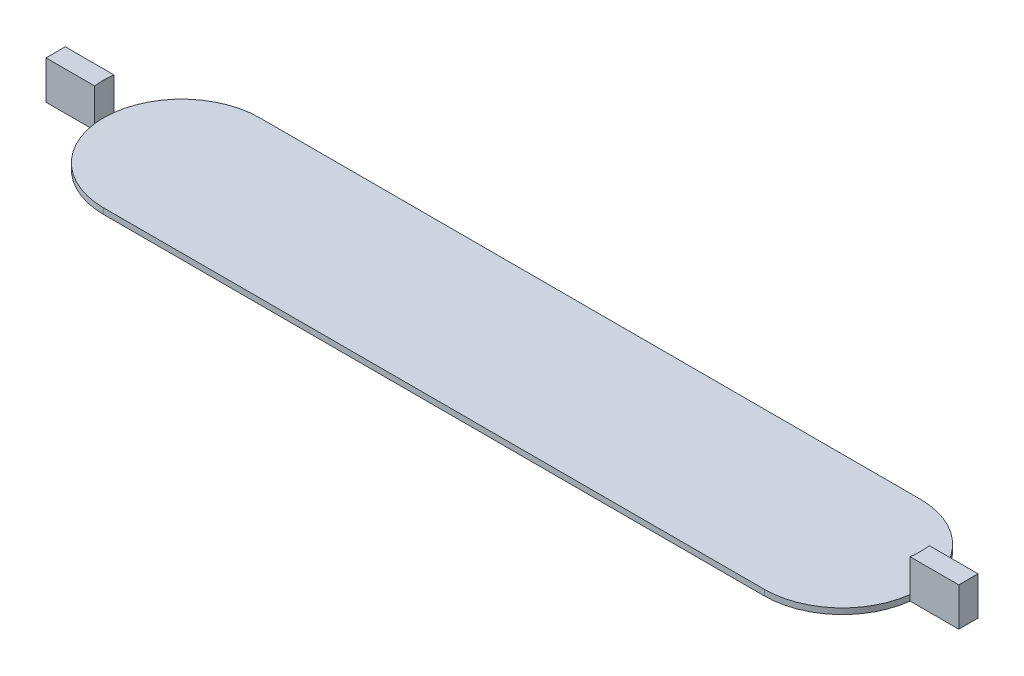
from build123d import *

# Parameters (mm, degrees)
BOSS_EXTRUDE1_DEPTH = 6
BOSS_EXTRUDE2_DEPTH = 40


with BuildPart() as part:
    # Sketch2 → Boss-Extrude1 (new body)
    with BuildSketch(Plane(origin=(0, 0, 0), x_dir=(1, 0, 0), z_dir=(0, 1, 0))):
        with BuildLine():
            Line((397.464433619, 39.544660738), (-290.127976468, 39.544660738))
            ThreePointArc((-290.127976468, 39.544660738), (-343.896082096, 19.193533205), (-370.713684353, -31.659134218))
            ThreePointArc((-370.713684353, -31.659134218), (-371.331771424, -41.659134218), (-370.713684353, -51.659134218))
            ThreePointArc((-370.713684353, -51.659134218), (-343.896082097, -102.511801641), (-290.127976468, -122.862929175))
            Line((-290.127976468, -122.862929175), (397.464433619, -122.862929175))
            ThreePointArc((397.464433619, -122.862929175), (451.232539249, -102.51180164), (478.050141505, -51.659134214))
            ThreePointArc((478.050141505, -51.659134214), (478.668228576, -41.659134214), (478.050141504, -31.659134214))
            ThreePointArc((478.050141504, -31.659134214), (451.232539246, 19.193533206), (397.464433619, 39.544660738))
        make_face()
    extrude(amount=BOSS_EXTRUDE1_DEPTH)

    # Sketch2<3> → Boss-Extrude2 (add)
    with BuildSketch(Plane(origin=(0, 0, 0), x_dir=(1, 0, 0), z_dir=(0, 1, 0))):
        with BuildLine():
            ThreePointArc((-370.713684353, -51.659134218), (-371.331771424, -41.659134218), (-370.713684353, -31.659134218))
            Line((-370.713684353, -31.659134218), (-421.331771424, -31.659134218))
            Line((-421.331771424, -31.659134218), (-421.331771424, -51.659134218))
            Line((-421.331771424, -51.659134218), (-370.713684353, -51.659134218))
        make_face()
        with BuildLine():
            Line((528.668228576, -31.659134214), (478.050141504, -31.659134214))
            ThreePointArc((478.050141504, -31.659134214), (478.668228576, -41.659134214), (478.050141505, -51.659134214))
            Line((478.050141505, -51.659134214), (528.668228576, -51.659134214))
            Line((528.668228576, -51.659134214), (528.668228576, -31.659134214))
        make_face()
    extrude(amount=BOSS_EXTRUDE2_DEPTH)


solid = part.part
